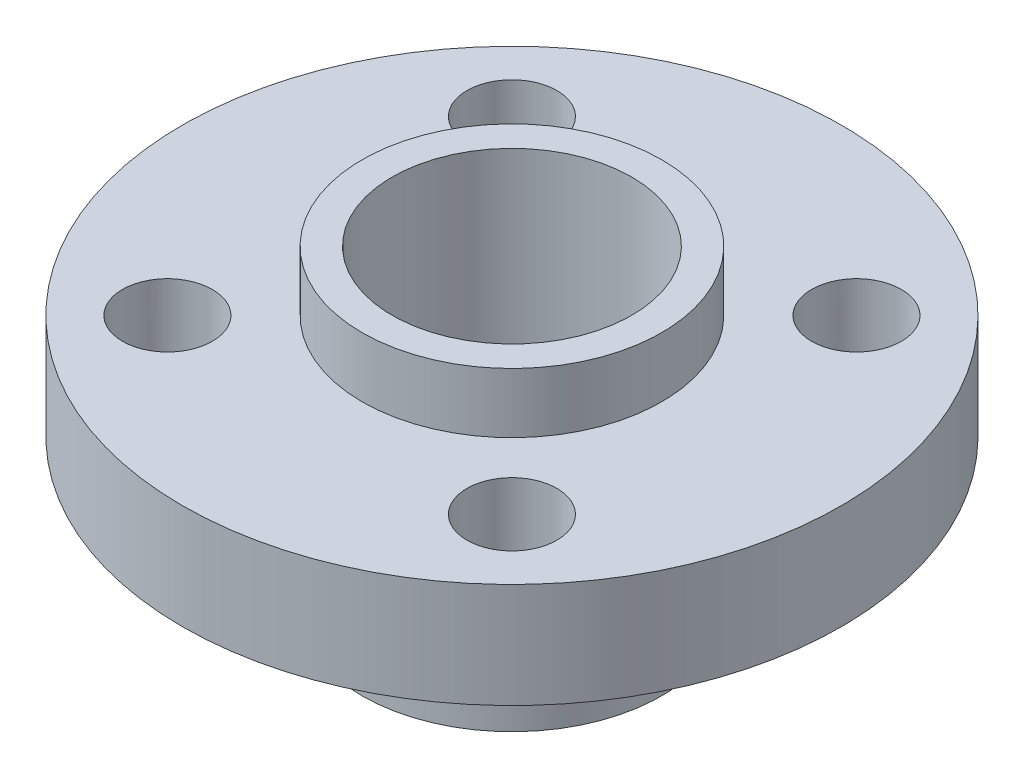
from build123d import *

# Parameters (mm, degrees)
SKETCH1_R           = 5
SKETCH1_R_2         = 4
BOSS_EXTRUDE1_DEPTH = 10.5
BOSS_EXTRUDE2_START = -2
SKETCH2_R           = 11
SKETCH2_R_2         = 4.5
BOSS_EXTRUDE2_DEPTH = 3.5
SKETCH3_R           = 1.5
CUT_EXTRUDE1_DEPTH  = 18.727097901


with BuildPart() as part:
    # Sketch1 → Boss-Extrude1 (new body)
    with BuildSketch(Plane(origin=(0, 0, 0), x_dir=(1, 0, 0), z_dir=(0, 1, 0))):
        with Locations(Location((0, 0, 0), (0, 0, 90))):
            Circle(SKETCH1_R)
        with Locations(Location((0, 0, 0), (0, 0, 90))):
            Circle(SKETCH1_R_2, mode=Mode.SUBTRACT)
    extrude(amount=BOSS_EXTRUDE1_DEPTH)

    # Sketch2 → Boss-Extrude2 (add)
    with BuildSketch(Plane(origin=(0, 10.5, 0), x_dir=(1, 0, 0), z_dir=(0, 1, 0)).offset(BOSS_EXTRUDE2_START)):
        with Locations(Location((0, 0, 0), (0, 0, 270))):
            Circle(SKETCH2_R)
        Circle(SKETCH2_R_2, mode=Mode.SUBTRACT)
    extrude(amount=-BOSS_EXTRUDE2_DEPTH)

    # Sketch3 → Cut-Extrude1 (cut, through all)
    with BuildSketch(Plane(origin=(0, 8.5, 0), x_dir=(1, 0, 0), z_dir=(0, 1, 0))):
        with Locations(Location((-5.75, 5.75, 0), (0, 0, 270))):
            Circle(SKETCH3_R)
        with Locations(Location((5.75, 5.75, 0), (0, 0, 270))):
            Circle(SKETCH3_R)
        with Locations(Location((5.75, -5.75, 0), (0, 0, 270))):
            Circle(SKETCH3_R)
        with Locations(Location((-5.75, -5.75, 0), (0, 0, 270))):
            Circle(SKETCH3_R)
    extrude(amount=-CUT_EXTRUDE1_DEPTH, mode=Mode.SUBTRACT)


solid = part.part
